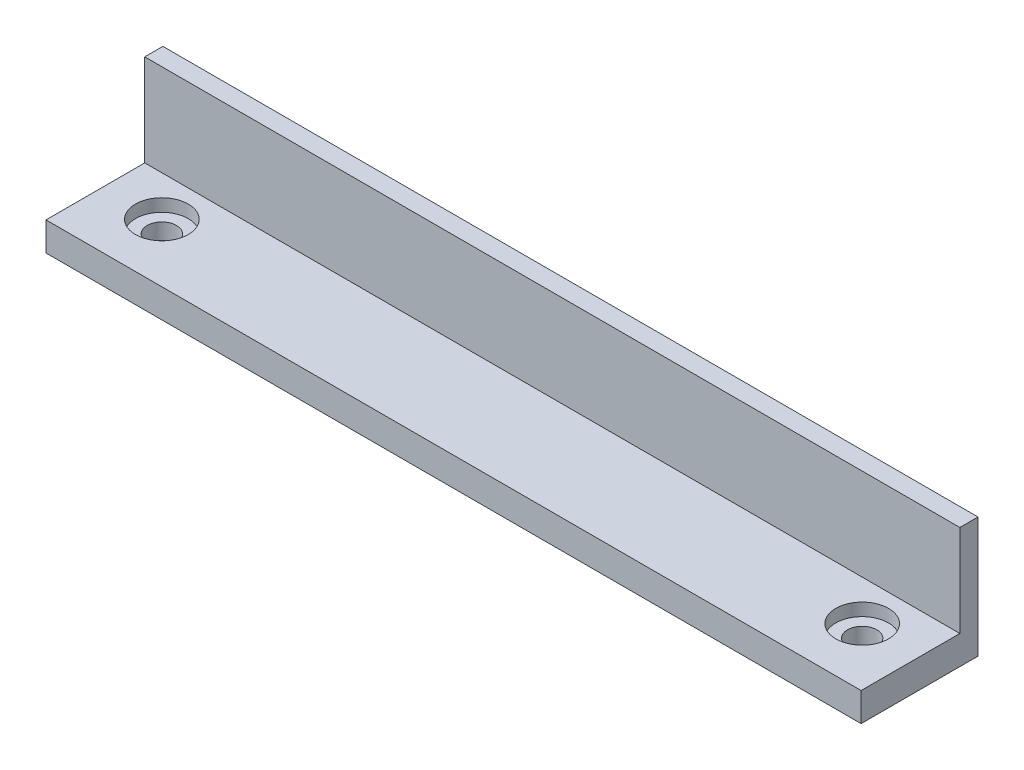
from build123d import *

# Parameters (mm, degrees)
SKETCH1_W           = 142
SKETCH1_H           = 17.2
SKETCH1_R           = 4.6
SKETCH1_H_2         = 3.16
SKETCH1_R_2         = 2.55
BOSS_EXTRUDE1_DEPTH = 5
BOSS_EXTRUDE2_START = 5
SKETCH1_3_W         = 142
SKETCH1_3_H         = 3.16
BOSS_EXTRUDE2_DEPTH = 16
CUT_EXTRUDE1_START  = 2.8
SKETCH1_5_R         = 4.6
SKETCH1_5_R_2       = 2.55
CUT_EXTRUDE1_DEPTH  = 2.2


with BuildPart() as part:
    # Sketch1 → Boss-Extrude1 (new body)
    # profile 1 of 4: a face of its own
    with BuildSketch(Plane(origin=(0, 0, 0), x_dir=(1, 0, 0), z_dir=(0, 1, 0))):
        with Locations((0, -1.58)):
            Rectangle(SKETCH1_W, SKETCH1_H)
        with Locations((-61, 0)):
            Circle(SKETCH1_R, mode=Mode.SUBTRACT)
        with Locations((61, 0)):
            Circle(SKETCH1_R, mode=Mode.SUBTRACT)
    # profile 2 of 4: a face of its own
    with BuildSketch(Plane(origin=(0, 0, 0), x_dir=(1, 0, 0), z_dir=(0, 1, 0))):
        with Locations((0, 8.6)):
            Rectangle(SKETCH1_W, SKETCH1_H_2)
    # profile 3 of 4: a face of its own
    with BuildSketch(Plane(origin=(0, 0, 0), x_dir=(1, 0, 0), z_dir=(0, 1, 0))):
        with Locations((-61, 0)):
            Circle(SKETCH1_R)
        with Locations(Location((-61, 0, 0), (0, 0, 270))):
            Circle(SKETCH1_R_2, mode=Mode.SUBTRACT)
    # profile 4 of 4: a face of its own
    with BuildSketch(Plane(origin=(0, 0, 0), x_dir=(1, 0, 0), z_dir=(0, 1, 0))):
        with Locations((61, 0)):
            Circle(SKETCH1_R)
        with Locations(Location((61, 0, 0), (0, 0, 270))):
            Circle(SKETCH1_R_2, mode=Mode.SUBTRACT)
    extrude(amount=BOSS_EXTRUDE1_DEPTH)

    # Sketch1<3> → Boss-Extrude2 (add)
    with BuildSketch(Plane(origin=(0, 0, 0), x_dir=(1, 0, 0), z_dir=(0, 1, 0)).offset(BOSS_EXTRUDE2_START)):
        with Locations((0, 8.6)):
            Rectangle(SKETCH1_3_W, SKETCH1_3_H)
    extrude(amount=BOSS_EXTRUDE2_DEPTH)

    # Sketch1<5> → Cut-Extrude1 (cut)
    # profile 1 of 2: a face of its own
    with BuildSketch(Plane(origin=(0, 0, 0), x_dir=(1, 0, 0), z_dir=(0, 1, 0)).offset(CUT_EXTRUDE1_START)):
        with Locations(Location((-61, 0, 0), (0, 0, 270))):
            Circle(SKETCH1_5_R)
        with Locations(Location((-61, 0, 0), (0, 0, 270))):
            Circle(SKETCH1_5_R_2, mode=Mode.SUBTRACT)
    # profile 2 of 2: a face of its own
    with BuildSketch(Plane(origin=(0, 0, 0), x_dir=(1, 0, 0), z_dir=(0, 1, 0)).offset(CUT_EXTRUDE1_START)):
        with Locations(Location((61, 0, 0), (0, 0, 270))):
            Circle(SKETCH1_5_R)
        with Locations(Location((61, 0, 0), (0, 0, 270))):
            Circle(SKETCH1_5_R_2, mode=Mode.SUBTRACT)
    extrude(amount=CUT_EXTRUDE1_DEPTH, mode=Mode.SUBTRACT)


solid = part.part
